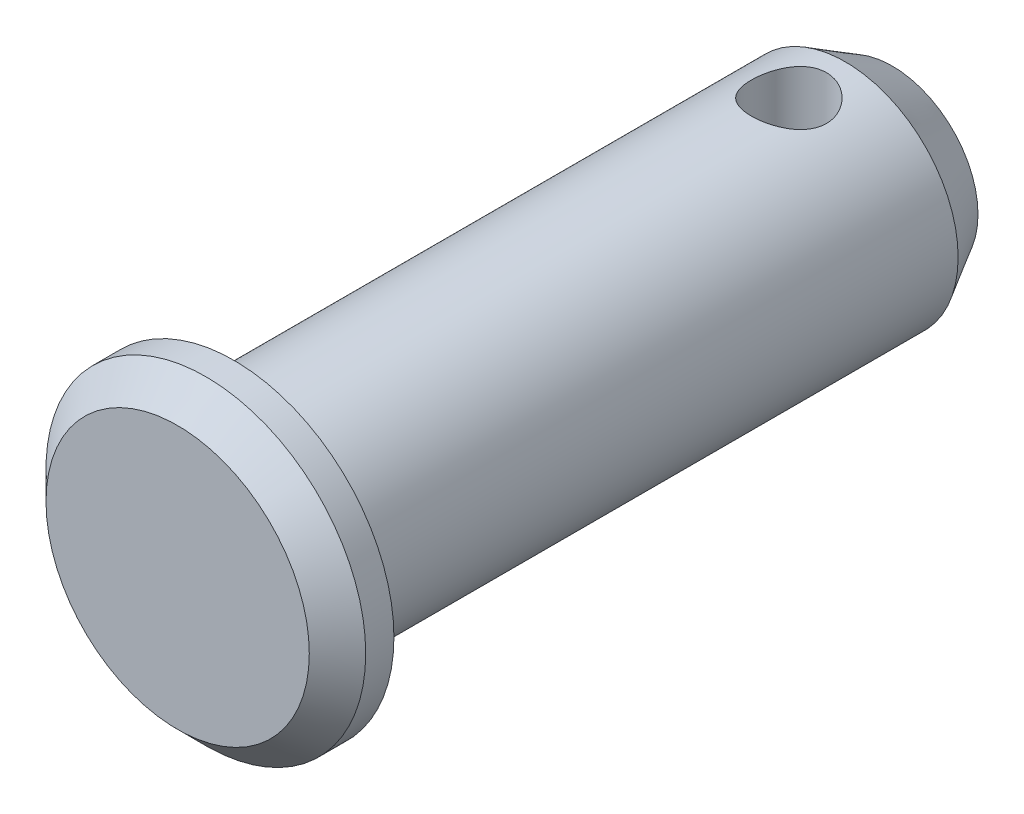
from build123d import *

# Parameters (mm, degrees)
WYTNIJ_WYCI_GNI_CIE1_DEPTH      = 23.483327156
WYTNIJ_WYCI_GNI_CIE1_DEPTH_BACK = 23.483327156
SZKIC2_R                        = 2


with BuildPart() as part:
    # Szkic1 → Obrót1 (revolve)
    with BuildSketch(Plane(origin=(0, 0, 0), x_dir=(1, 0, 0), z_dir=(0, 1, 0))):
        Polygon((0, -19), (7, -19), (8.5, -17.5), (8.5, -16), (6, -16), (6, 16.5), (4.556624327, 19), (0, 19), align=None)
    revolve(axis=Axis((0, 0, 19), (0, 0, -1)))

    # Szkic2 → Wytnij-wyciągnięcie1 (cut, two sides: drawn at the far end of the back side and taken through both)
    with BuildSketch(Plane(origin=(0, 0, 0), x_dir=(1, 0, 0), z_dir=(0, 1, 0)).offset(-WYTNIJ_WYCI_GNI_CIE1_DEPTH_BACK)):
        with Locations(Location((0, 13.5, 0), (0, 0, 270))):
            Circle(SZKIC2_R)
    extrude(amount=WYTNIJ_WYCI_GNI_CIE1_DEPTH + WYTNIJ_WYCI_GNI_CIE1_DEPTH_BACK, mode=Mode.SUBTRACT)


solid = part.part
